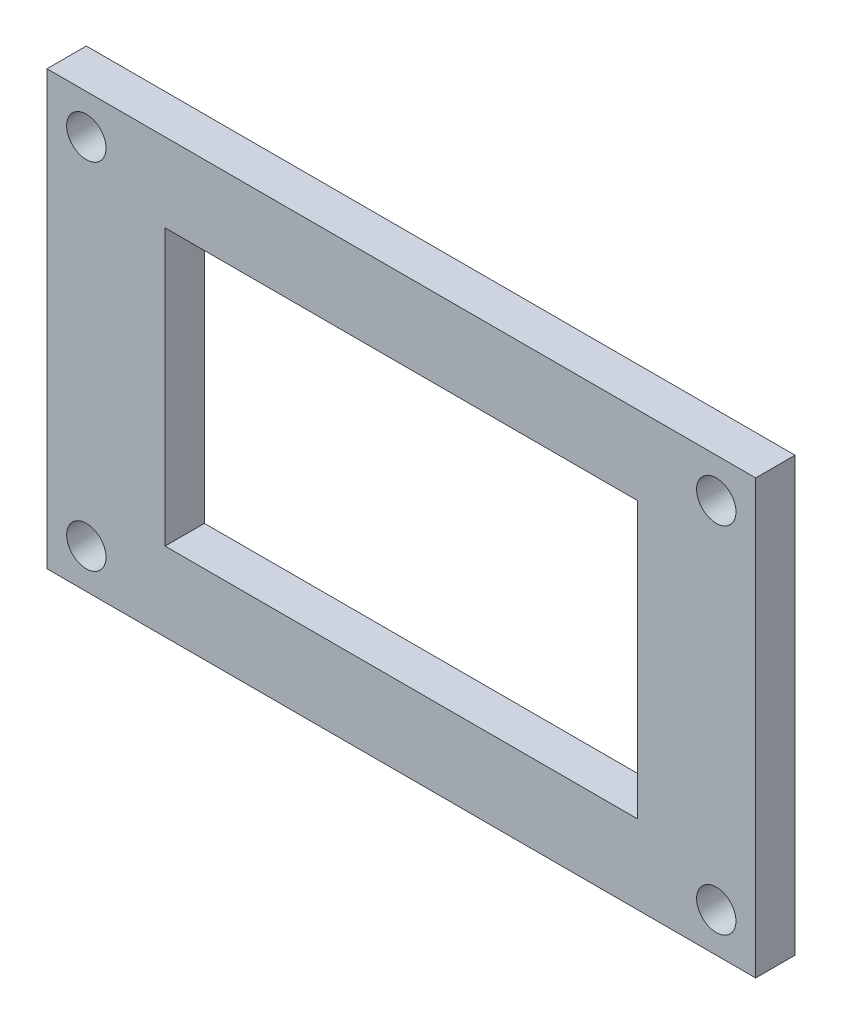
from build123d import *

# Parameters (mm, degrees)
SKETCH1_W           = 57.15
SKETCH1_H           = 34.925
SKETCH1_W_2         = 38.1
SKETCH1_H_2         = 22.225
BOSS_EXTRUDE1_DEPTH = 3.175
SKETCH2_R           = 1.5875
CUT_EXTRUDE1_DEPTH  = 3.175


with BuildPart() as part:
    # Sketch1 → Boss-Extrude1 (new body)
    with BuildSketch(Plane.XY):
        Rectangle(SKETCH1_W, SKETCH1_H)
        Rectangle(SKETCH1_W_2, SKETCH1_H_2, mode=Mode.SUBTRACT)
    extrude(amount=BOSS_EXTRUDE1_DEPTH)

    # Sketch2 → Cut-Extrude1 (cut)
    with BuildSketch(Plane(origin=(0, 0, 0), x_dir=(-1, 0, 0), z_dir=(0, 0, -1))):
        with Locations((-25.4, -14.2875)):
            Circle(SKETCH2_R)
        with Locations((-25.4, 14.2875)):
            Circle(SKETCH2_R)
        with Locations((25.4, 14.2875)):
            Circle(SKETCH2_R)
        with Locations((25.4, -14.2875)):
            Circle(SKETCH2_R)
    extrude(amount=-CUT_EXTRUDE1_DEPTH, mode=Mode.SUBTRACT)


solid = part.part
